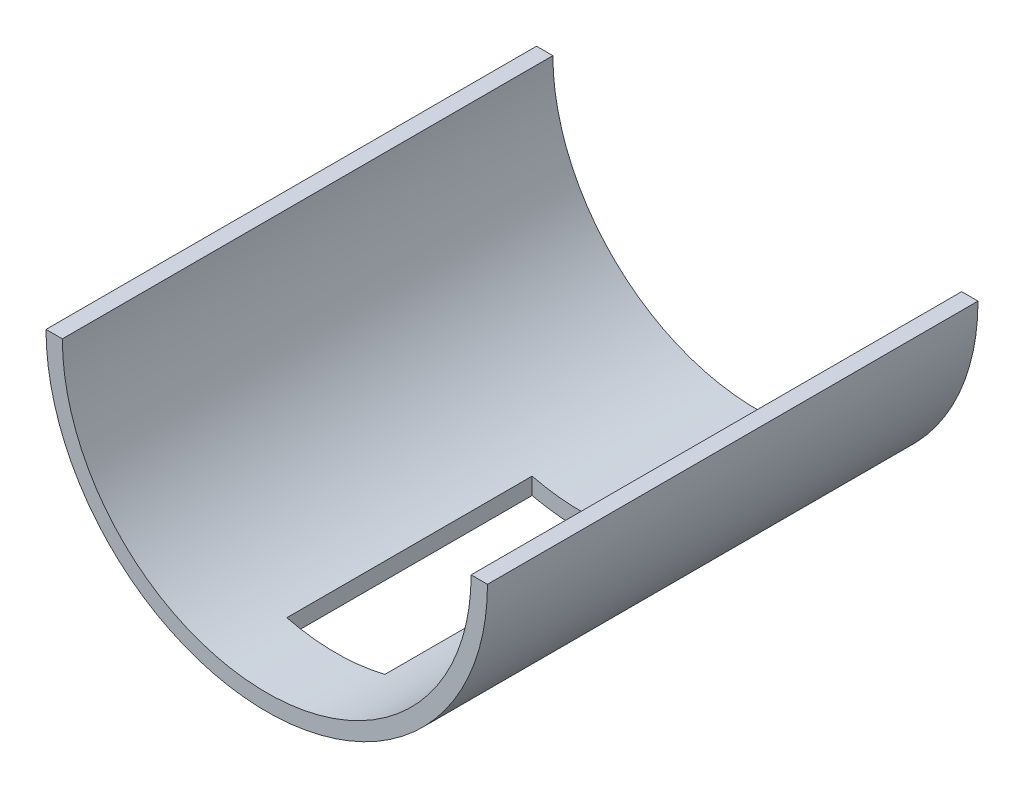
from build123d import *

# Parameters (mm, degrees)
BOSS_EXTRU_1_DEPTH      = 60
ESQUISSE2_W             = 12
ESQUISSE2_H             = 30
ENL_V_MAT_EXTRU_1_DEPTH = 72.119617547


with BuildPart() as part:
    # Esquisse1 → Boss.-Extru.1 (new body)
    with BuildSketch(Plane.XY):
        with BuildLine():
            Line((-27, 0), (-25, 0))
            ThreePointArc((-25, 0), (0, -25), (25, 0))
            Line((25, 0), (27, 0))
            ThreePointArc((27, 0), (0, -27), (-27, 0))
        make_face()
    extrude(amount=BOSS_EXTRU_1_DEPTH)

    # Esquisse2 → Enlèv. mat.-Extru.1 (cut, through all)
    with BuildSketch(Plane(origin=(0, 0, 0), x_dir=(1, 0, 0), z_dir=(0, 1, 0))):
        with Locations((0, -36.544954045)):
            Rectangle(ESQUISSE2_W, ESQUISSE2_H)
    extrude(amount=-ENL_V_MAT_EXTRU_1_DEPTH, mode=Mode.SUBTRACT)


solid = part.part
